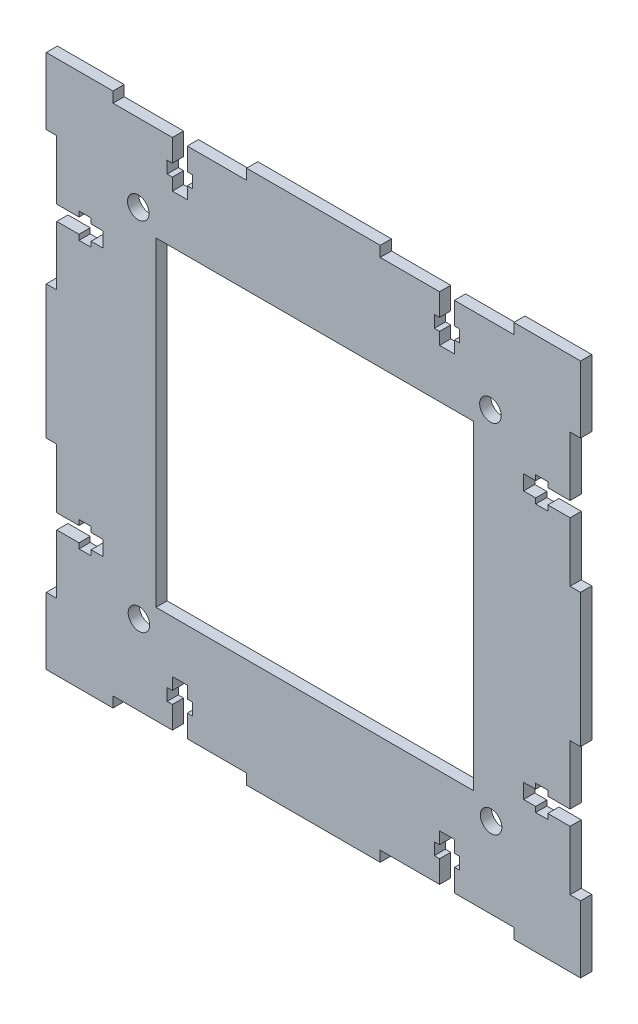
from build123d import *

# Parameters (mm, degrees)
SKETCH1_R           = 3.05
SKETCH1_W           = 89.973098966
SKETCH1_H           = 90.646237782
BOSS_EXTRUDE1_DEPTH = 3.175


with BuildPart() as part:
    # Sketch1 → Boss-Extrude1 (new body)
    with BuildSketch(Plane.XY):
        Polygon((0, 308.79500376), (0, 289.867896869), (2.980646754, 289.867896869), (2.980646754, 273.05208143), (9.289682385, 273.05208143), (9.289682385, 274.542404807), (12.717426152, 274.542404807), (12.717426152, 273.05208143), (16.14516992, 273.05208143), (16.14516992, 268.829498528), (12.717426152, 268.829498528), (12.717426152, 267.33917515), (9.289682385, 267.33917515), (9.289682385, 268.829498528), (2.980646754, 268.829498528), (2.980646754, 252.013683088), (0, 252.013683088), (0, 214.159469307), (2.980646754, 214.159469307), (2.980646754, 197.343653867), (9.289682385, 197.343653867), (9.289682385, 198.833977244), (12.717426152, 198.833977244), (12.717426152, 197.343653867), (16.14516992, 197.343653867), (16.14516992, 193.121070965), (12.717426152, 193.121070965), (12.717426152, 191.630747588), (9.289682385, 191.630747588), (9.289682385, 193.121070965), (2.980646754, 193.121070965), (2.980646754, 176.305255525), (0, 176.305255525), (0, 157.378148634), (18.927106891, 157.378148634), (18.927106891, 160.358795389), (35.74292233, 160.358795389), (35.74292233, 166.667831019), (34.252598953, 166.667831019), (34.252598953, 170.095574787), (35.74292233, 170.095574787), (35.74292233, 173.523318554), (39.965505232, 173.523318554), (39.965505232, 170.095574787), (41.45582861, 170.095574787), (41.45582861, 166.667831019), (39.965505232, 166.667831019), (39.965505232, 160.358795389), (56.781320672, 160.358795389), (56.781320672, 157.378148634), (94.635534454, 157.378148634), (94.635534454, 160.358795389), (111.451349893, 160.358795389), (111.451349893, 166.667831019), (109.961026516, 166.667831019), (109.961026516, 170.095574787), (111.451349893, 170.095574787), (111.451349893, 173.523318554), (115.673932795, 173.523318554), (115.673932795, 170.095574787), (117.164256172, 170.095574787), (117.164256172, 166.667831019), (115.673932795, 166.667831019), (115.673932795, 160.358795389), (132.489748235, 160.358795389), (132.489748235, 157.378148634), (151.416855126, 157.378148634), (151.416855126, 176.305255525), (148.436208371, 176.305255525), (148.436208371, 193.121070965), (142.127172741, 193.121070965), (142.127172741, 191.630747588), (138.699428973, 191.630747588), (138.699428973, 193.121070965), (135.271685206, 193.121070965), (135.271685206, 197.343653867), (138.699428973, 197.343653867), (138.699428973, 198.833977244), (142.127172741, 198.833977244), (142.127172741, 197.343653867), (148.436208371, 197.343653867), (148.436208371, 214.159469307), (151.416855126, 214.159469307), (151.416855126, 252.013683088), (148.436208371, 252.013683088), (148.436208371, 268.829498528), (142.127172741, 268.829498528), (142.127172741, 267.33917515), (138.699428973, 267.33917515), (138.699428973, 268.829498528), (135.271685206, 268.829498528), (135.271685206, 273.05208143), (138.699428973, 273.05208143), (138.699428973, 274.542404807), (142.127172741, 274.542404807), (142.127172741, 273.05208143), (148.436208371, 273.05208143), (148.436208371, 289.867896869), (151.416855126, 289.867896869), (151.416855126, 308.79500376), (132.489748235, 308.79500376), (132.489748235, 305.814357006), (115.673932795, 305.814357006), (115.673932795, 299.505321375), (117.164256172, 299.505321375), (117.164256172, 296.077577608), (115.673932795, 296.077577608), (115.673932795, 292.64983384), (111.451349893, 292.64983384), (111.451349893, 296.077577608), (109.961026516, 296.077577608), (109.961026516, 299.505321375), (111.451349893, 299.505321375), (111.451349893, 305.814357006), (94.635534454, 305.814357006), (94.635534454, 308.79500376), (56.781320672, 308.79500376), (56.781320672, 305.814357006), (39.965505232, 305.814357006), (39.965505232, 299.505321375), (41.45582861, 299.505321375), (41.45582861, 296.077577608), (39.965505232, 296.077577608), (39.965505232, 292.64983384), (35.74292233, 292.64983384), (35.74292233, 296.077577608), (34.252598953, 296.077577608), (34.252598953, 299.505321375), (35.74292233, 299.505321375), (35.74292233, 305.814357006), (18.927106891, 305.814357006), (18.927106891, 308.79500376), align=None)
        with Locations((26.087654184, 283.82694987)):
            Circle(SKETCH1_R, mode=Mode.SUBTRACT)
        with Locations(Location((125.873209609, 284.070712088, 0), (0, 0, 180))):
            Circle(SKETCH1_R, mode=Mode.SUBTRACT)
        with Locations((126.06075315, 183.180712088)):
            Circle(SKETCH1_R, mode=Mode.SUBTRACT)
        with Locations(Location((26.27542779, 182.933192277, 0), (0, 0, 180))):
            Circle(SKETCH1_R, mode=Mode.SUBTRACT)
        with Locations((76.074203667, 233.503830979)):
            Rectangle(SKETCH1_W, SKETCH1_H, mode=Mode.SUBTRACT)
    extrude(amount=BOSS_EXTRUDE1_DEPTH)


solid = part.part
